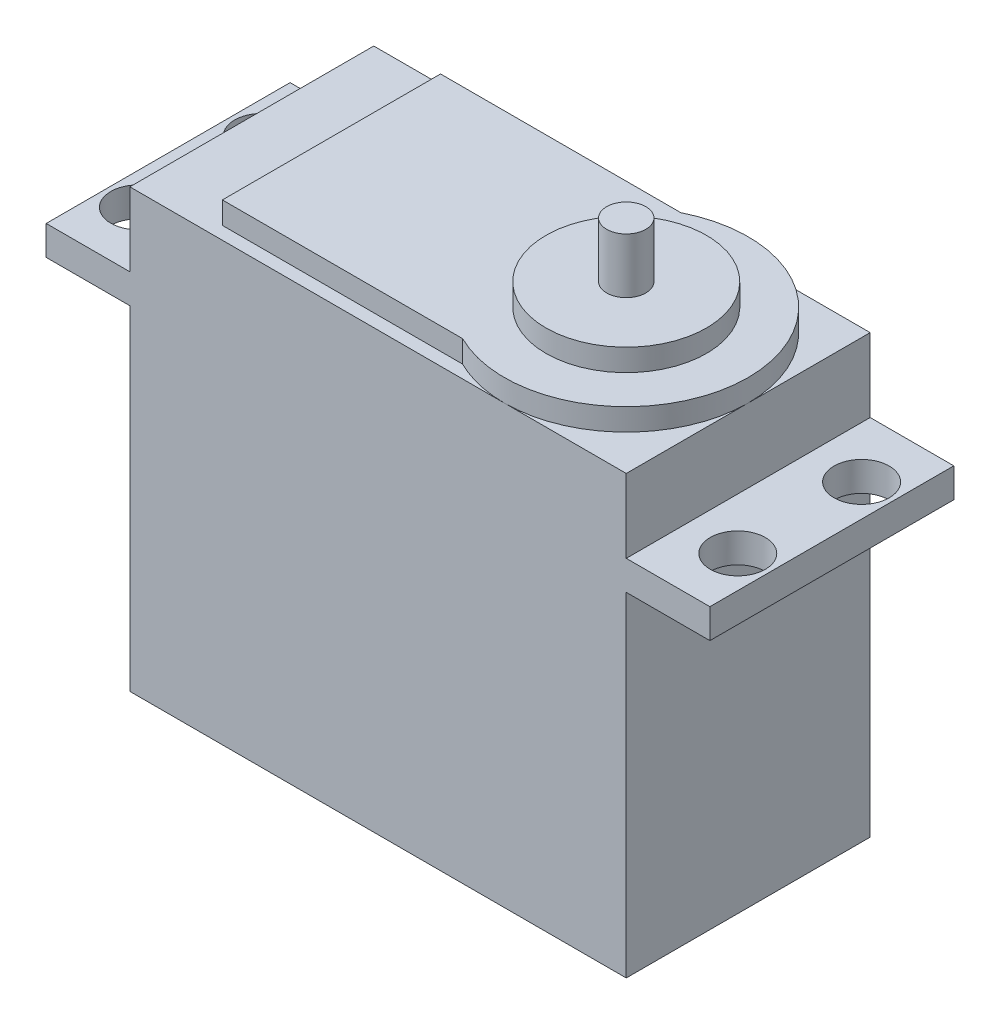
from build123d import *

# Parameters (mm, degrees)
SKETCH_1_W          = 40.5
SKETCH_1_H          = 19.9
EXTRUDE_1_DEPTH     = 28.25
SKETCH_2_W          = 54.15
SKETCH_2_H          = 19.9
EXTRUDE_2_DEPTH     = 2.4
SKETCH_3_W          = 40.5
SKETCH_3_H          = 19.9
EXTRUDE_3_DEPTH     = 6
SKETCH_4_R          = 9.95
SKETCH_4_W          = 19.601123737
SKETCH_4_H          = 17.8
EXTRUDE_4_DEPTH     = 1.8
SKETCH_5_R          = 6.55
EXTRUDE_5_DEPTH     = 1.8
SKETCH_6_R          = 1.6
EXTRUDE_6_DEPTH     = 4.5
SKETCH_7_R          = 2.25
CUT_EXTRUDE_1_DEPTH = 43.088960845
CHAMFER_1_SIZE      = 1


with BuildPart() as part:
    # 草图1 → 凸台-拉伸1 (new body)
    with BuildSketch(Plane(origin=(0, 0, 0), x_dir=(1, 0, 0), z_dir=(0, 1, 0))):
        Rectangle(SKETCH_1_W, SKETCH_1_H)
    extrude(amount=EXTRUDE_1_DEPTH)

    # 草图2 → 凸台-拉伸2 (add)
    with BuildSketch(Plane(origin=(0, 28.25, 0), x_dir=(1, 0, 0), z_dir=(0, 1, 0))):
        Rectangle(SKETCH_2_W, SKETCH_2_H)
    extrude(amount=EXTRUDE_2_DEPTH)

    # 草图3 → 凸台-拉伸3 (add)
    with BuildSketch(Plane(origin=(0, 30.65, 0), x_dir=(1, 0, 0), z_dir=(0, 1, 0))):
        Rectangle(SKETCH_3_W, SKETCH_3_H)
    extrude(amount=EXTRUDE_3_DEPTH)

    # 草图4 → 凸台-拉伸4 (add)
    with BuildSketch(Plane(origin=(0, 36.65, 0), x_dir=(1, 0, 0), z_dir=(0, 1, 0))):
        with Locations((10.3, 0)):
            Circle(SKETCH_4_R)
        with Locations((-3.949438132, 0)):
            Rectangle(SKETCH_4_W, SKETCH_4_H)
    extrude(amount=EXTRUDE_4_DEPTH)

    # 草图5 → 凸台-拉伸5 (add)
    with BuildSketch(Plane(origin=(0, 38.45, 0), x_dir=(1, 0, 0), z_dir=(0, 1, 0))):
        with Locations(Location((10.3, 0, 0), (0, 0, 270))):
            Circle(SKETCH_5_R)
    extrude(amount=EXTRUDE_5_DEPTH)

    # 草图6 → 凸台-拉伸6 (add)
    with BuildSketch(Plane(origin=(0, 40.25, 0), x_dir=(1, 0, 0), z_dir=(0, 1, 0))):
        with Locations(Location((10.3, 0, 0), (0, 0, 270))):
            Circle(SKETCH_6_R)
    extrude(amount=EXTRUDE_6_DEPTH)

    # 草图7 → 切除-拉伸1 (cut, through all)
    with BuildSketch(Plane(origin=(0, 30.65, 0), x_dir=(1, 0, 0), z_dir=(0, 1, 0))):
        with Locations(Location((24.45, -5.05, 0), (0, 0, 270))):
            Circle(SKETCH_7_R)
        with Locations(Location((24.45, 5.05, 0), (0, 0, 270))):
            Circle(SKETCH_7_R)
        with Locations(Location((-24.45, 5.05, 0), (0, 0, 270))):
            Circle(SKETCH_7_R)
        with Locations(Location((-24.45, -5.05, 0), (0, 0, 270))):
            Circle(SKETCH_7_R)
    extrude(amount=-CUT_EXTRUDE_1_DEPTH, mode=Mode.SUBTRACT)

    # 倒角1
    chamfer_1_edges = [part.edges().sort_by_distance(p)[0] for p in [
        (0, 0, 9.95),
        (-20.25, 0, 0),
        (0, 0, -9.95),
        (20.25, 0, 0),
    ]]
    chamfer(chamfer_1_edges, length=CHAMFER_1_SIZE)


solid = part.part
